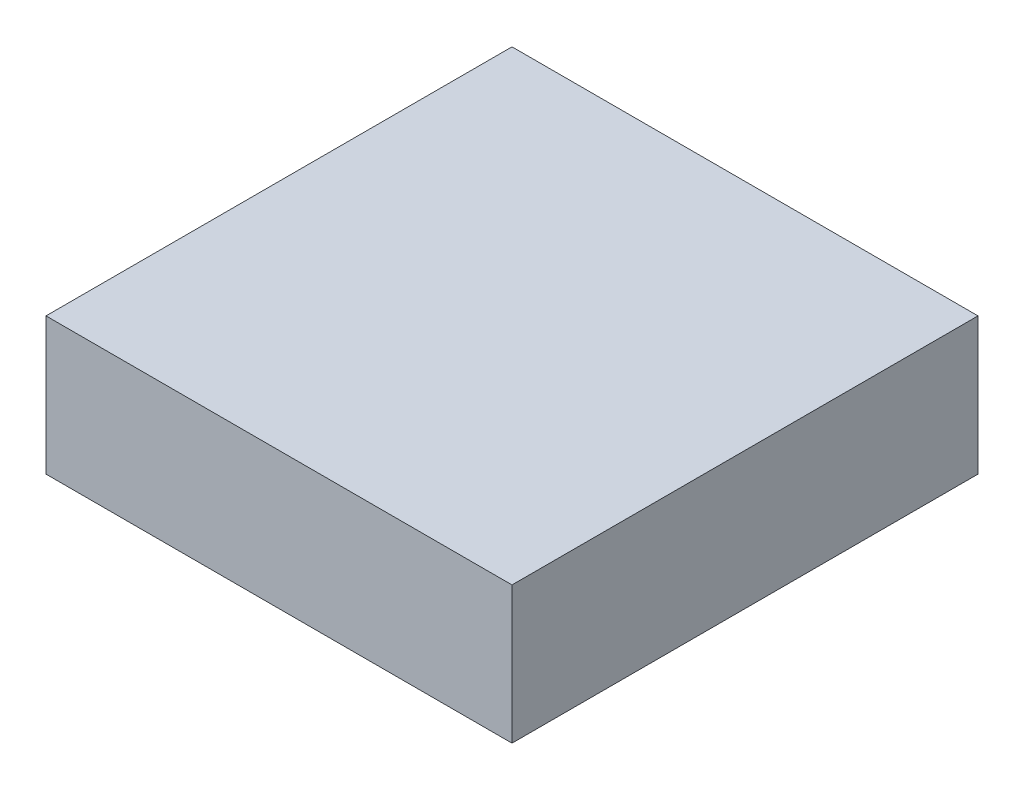
from build123d import *

# Parameters (mm, degrees)
SKETCH2_W           = 431.8
SKETCH2_H           = 431.8
BOSS_EXTRUDE1_DEPTH = 127


with BuildPart() as part:
    # Sketch2 → Boss-Extrude1 (new body)
    with BuildSketch(Plane(origin=(0, 0, 0), x_dir=(1, 0, 0), z_dir=(0, 1, 0))):
        with Locations((215.9, 215.9)):
            Rectangle(SKETCH2_W, SKETCH2_H)
    extrude(amount=BOSS_EXTRUDE1_DEPTH)


solid = part.part
